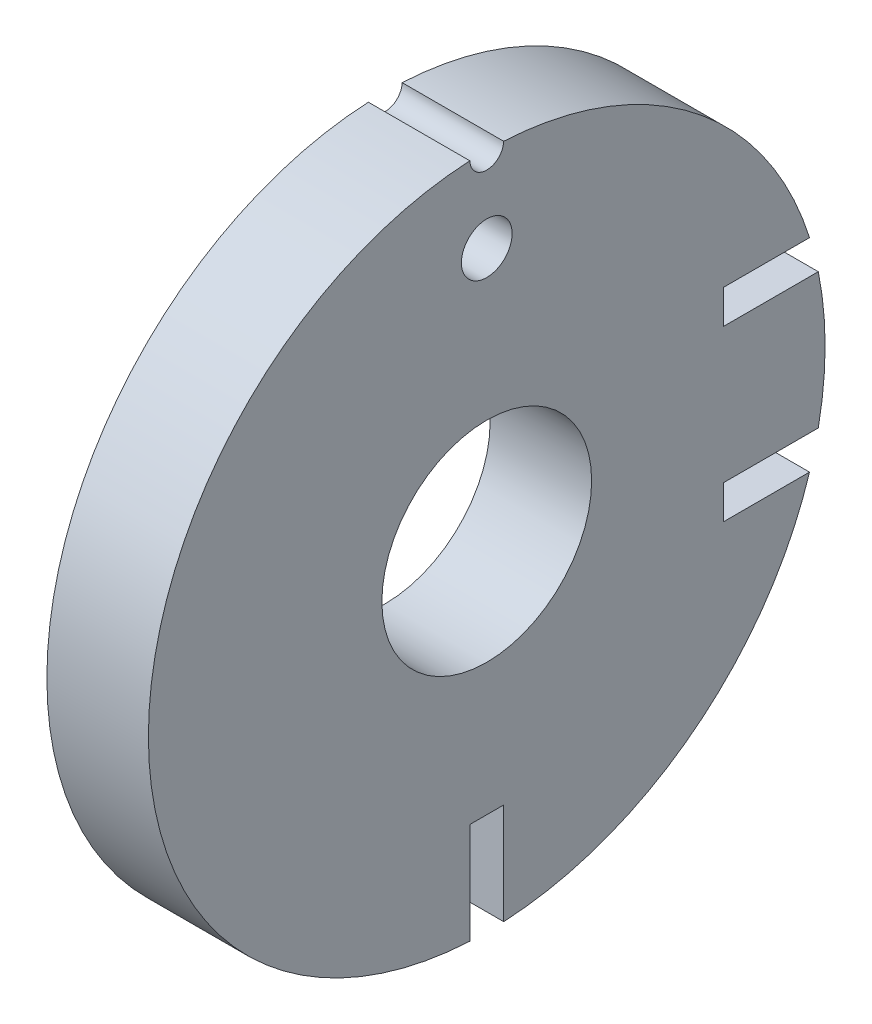
from build123d import *

# Parameters (mm, degrees)
SKETCH1_R           = 10
SKETCH1_R_2         = 3.1
BOSS_EXTRUDE1_DEPTH = 3
SKETCH2_R           = 0.75
SKETCH2_R_2         = 0.5
SKETCH2_W           = 5.709686215
SKETCH2_H           = 1
SKETCH2_W_2         = 1
SKETCH2_H_2         = 4.505813393
CUT_EXTRUDE1_DEPTH  = 3


with BuildPart() as part:
    # Sketch1 → Boss-Extrude1 (new body)
    with BuildSketch(Plane(origin=(0, 0, 0), x_dir=(0, 0, -1), z_dir=(1, 0, 0))):
        Circle(SKETCH1_R)
        Circle(SKETCH1_R_2, mode=Mode.SUBTRACT)
    extrude(amount=BOSS_EXTRUDE1_DEPTH)

    # Sketch2 → Cut-Extrude1 (cut)
    with BuildSketch(Plane(origin=(3, 0, 0), x_dir=(0, 0, -1), z_dir=(1, 0, 0))):
        with Locations((0, 7.5)):
            Circle(SKETCH2_R)
        with Locations((0, 10)):
            Circle(SKETCH2_R_2)
        with Locations((9.854843108, 2.5)):
            Rectangle(SKETCH2_W, SKETCH2_H)
        with Locations((9.854843108, -2.5)):
            Rectangle(SKETCH2_W, SKETCH2_H)
        with Locations((0, -9.252906697)):
            Rectangle(SKETCH2_W_2, SKETCH2_H_2)
    extrude(amount=-CUT_EXTRUDE1_DEPTH, mode=Mode.SUBTRACT)


solid = part.part
